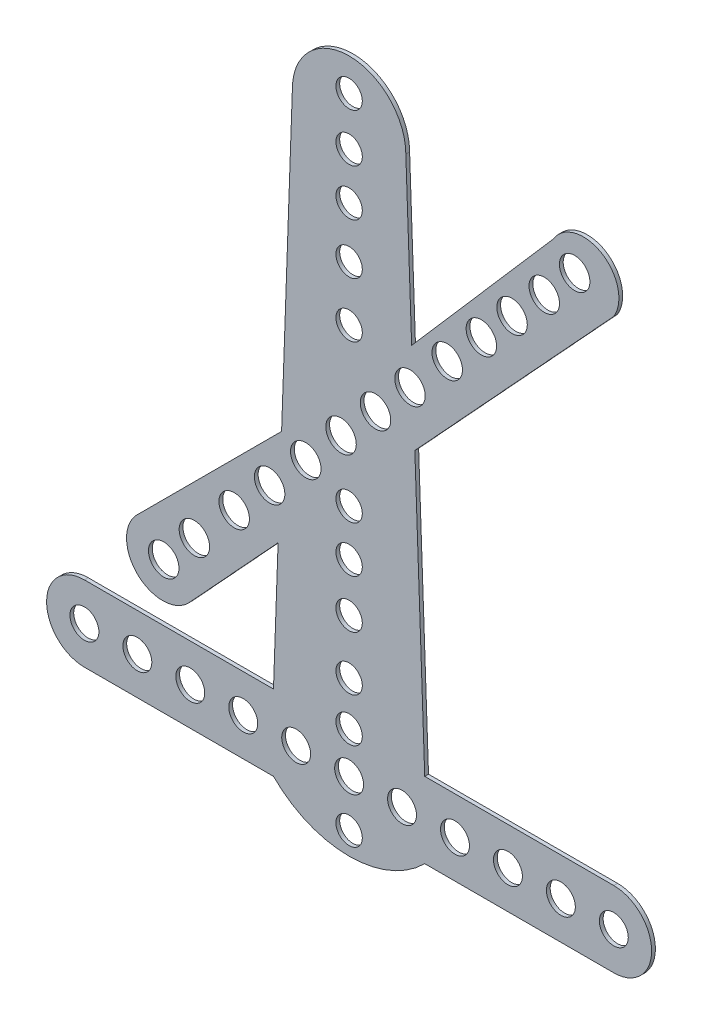
from build123d import *

# Parameters (mm, degrees)
BOSS_EXTRUDE2_DEPTH = 5
SKETCH2_R           = 19.127666072
SKETCH2_R_2         = 17.449363928
SKETCH2_R_3         = 20.149507696
CUT_EXTRUDE1_DEPTH  = 60


with BuildPart() as part:
    # Sketch1 → Boss-Extrude2 (new body)
    with BuildSketch(Plane.XY):
        with BuildLine():
            Line((-75, 383.908045977), (-89.272030651, -15.708812261))
            Line((-89.272030651, -15.708812261), (-282.566478984, -209.003260593))
            ThreePointArc((-282.566478984, -209.003260593), (-277.81350135, -276.433117622), (-210.383644321, -271.680139987))
            Line((-210.383644321, -271.680139987), (-93.90556369, -145.447737332))
            Line((-93.90556369, -145.447737332), (-100, -316.091954023))
            Line((-100, -316.091954023), (-350, -316.091954023))
            ThreePointArc((-350, -316.091954023), (-400, -366.091954023), (-350, -416.091954023))
            Line((-350, -416.091954023), (-100, -416.091954023))
            ThreePointArc((-100, -416.091954023), (0, -457.51331026), (100, -416.091954023))
            Line((100, -416.091954023), (350, -416.091954023))
            ThreePointArc((350, -416.091954023), (400, -366.091954023), (350, -316.091954023))
            Line((350, -316.091954023), (100, -316.091954023))
            Line((100, -316.091954023), (86.907181572, 50.506961966))
            Line((86.907181572, 50.506961966), (350, 335.632183908))
            ThreePointArc((350, 335.632183908), (333.983863171, 399.924182806), (269.691864273, 383.908045977))
            Line((269.691864273, 383.908045977), (82.685549205, 168.712668231))
            Line((82.685549205, 168.712668231), (75, 383.908045977))
            ThreePointArc((75, 383.908045977), (0, 458.908045977), (-75, 383.908045977))
        make_face()
    extrude(amount=BOSS_EXTRUDE2_DEPTH)

    # Sketch2 → Cut-Extrude1 (cut)
    with BuildSketch(Plane.XY.offset(5)):
        with Locations((-280, -366.091954023)):
            Circle(SKETCH2_R)
        with Locations((-210, -366.091954023)):
            Circle(SKETCH2_R)
        with Locations((-350, -366.091954023)):
            Circle(SKETCH2_R)
        with Locations((-140, -366.091954023)):
            Circle(SKETCH2_R)
        with Locations((-70, -366.091954023)):
            Circle(SKETCH2_R)
        with Locations((0, -366.091954023)):
            Circle(SKETCH2_R)
        with Locations((70, -366.091954023)):
            Circle(SKETCH2_R)
        with Locations((140, -366.091954023)):
            Circle(SKETCH2_R)
        with Locations((210, -366.091954023)):
            Circle(SKETCH2_R)
        with Locations((280, -366.091954023)):
            Circle(SKETCH2_R)
        with Locations((350, -366.091954023)):
            Circle(SKETCH2_R)
        with Locations((0, 415.848503824)):
            Circle(SKETCH2_R_2)
        with Locations((0, 352.103321769)):
            Circle(SKETCH2_R_2)
        with Locations((0, 290.357789176)):
            Circle(SKETCH2_R_2)
        with Locations((0, 223.223112333)):
            Circle(SKETCH2_R_2)
        with Locations((0, 150.590486971)):
            Circle(SKETCH2_R_2)
        with Locations((0, -56.606498774)):
            Circle(SKETCH2_R_2)
        with Locations((0, -117.853104706)):
            Circle(SKETCH2_R_2)
        with Locations((0, -181.842565513)):
            Circle(SKETCH2_R_2)
        with Locations((0, -253.635619101)):
            Circle(SKETCH2_R_2)
        with Locations((0, -311.755022078)):
            Circle(SKETCH2_R_2)
        with Locations((0, -427.95103023)):
            Circle(SKETCH2_R_2)
        with Locations((-245.128862806, -240.299431579)):
            Circle(SKETCH2_R_3)
        with Locations((-204.579359837, -195.470941049)):
            Circle(SKETCH2_R_3)
        with Locations((-151.934117667, -137.270308063)):
            Circle(SKETCH2_R_3)
        with Locations((-105.128862806, -85.525927228)):
            Circle(SKETCH2_R_3)
        with Locations((-57.302051438, -32.652190104)):
            Circle(SKETCH2_R_3)
        with Locations((-10.671022438, 18.899579681)):
            Circle(SKETCH2_R_3)
        with Locations((34.871137194, 69.247577124)):
            Circle(SKETCH2_R_3)
        with Locations((80.497867488, 119.68906955)):
            Circle(SKETCH2_R_3)
        with Locations((129.746983315, 174.135199855)):
            Circle(SKETCH2_R_3)
        with Locations((174.871137194, 224.021081476)):
            Circle(SKETCH2_R_3)
        with Locations((215.441503687, 268.872637154)):
            Circle(SKETCH2_R_3)
        with Locations((258.052096157, 314.419110743)):
            Circle(SKETCH2_R_3)
        with Locations((298.226980998, 359.414981764)):
            Circle(SKETCH2_R_3)
    extrude(amount=-CUT_EXTRUDE1_DEPTH, mode=Mode.SUBTRACT)


solid = part.part
